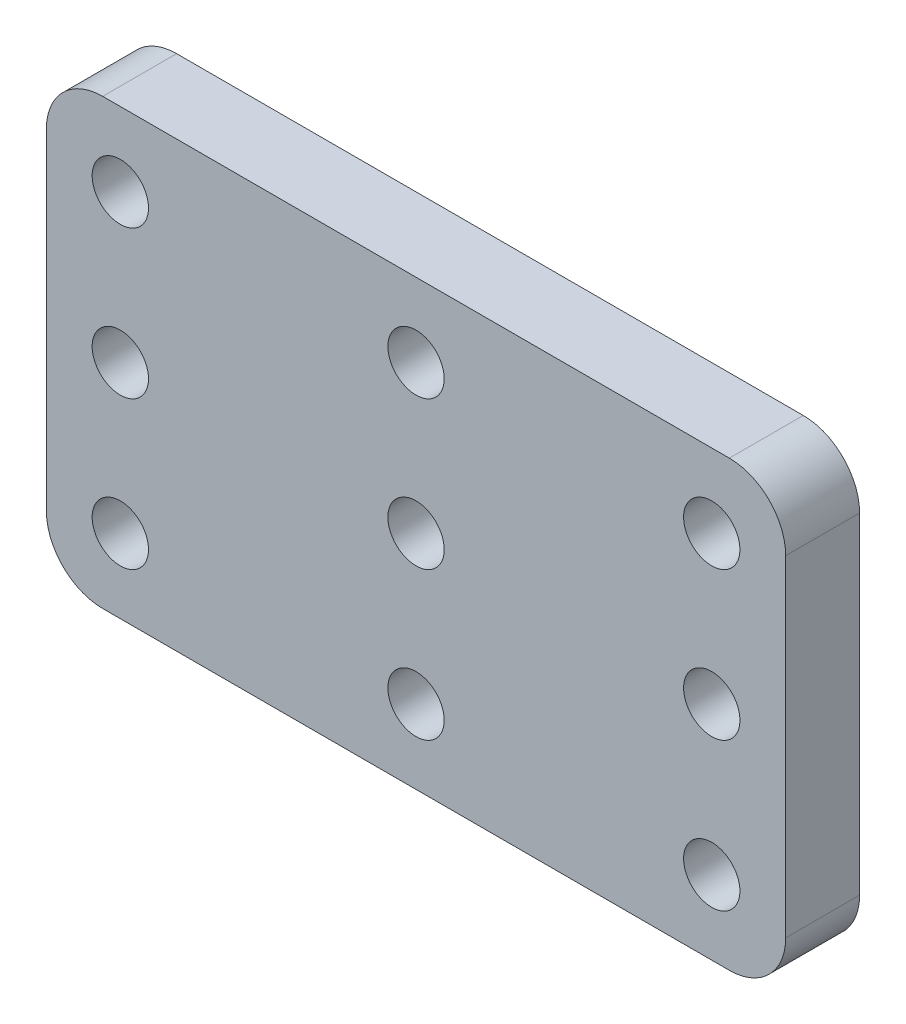
from build123d import *

# Parameters (mm, degrees)
SKETCH1_W                     = 49.9999
SKETCH1_H                     = 29.99994
BOSS_EXTRUDE1_DEPTH           = 4.99999
SKETCH2_R                     = 1.905
CUT_EXTRUDE1_DEPTH            = 4.99999
LPATTERN1_COUNT               = 2
LPATTERN1_PITCH               = 9.99998
LPATTERN1_COL_COUNT           = 2
LPATTERN1_COL_PITCH           = 9.99998
LPATTERN2_COUNT               = 2
LPATTERN2_PITCH               = 19.99996
LPATTERN2_COPY_1_SKETCH_R     = 1.905
LPATTERN2_COPY_1_DEPTH        = 4.99999
LPATTERN2_COPY_2_SKETCH_R     = 1.905
LPATTERN2_COPY_2_DEPTH        = 4.99999
LPATTERN2_COL_COUNT           = 2
LPATTERN2_COL_PITCH           = 19.99996
LPATTERN2_COL_COPY_1_SKETCH_R = 1.905
LPATTERN2_COL_COPY_1_DEPTH    = 4.99999
LPATTERN2_COL_COPY_2_SKETCH_R = 1.905
LPATTERN2_COL_COPY_2_DEPTH    = 4.99999
FILLET1_R                     = 3.81


with BuildPart() as part:
    # Sketch1 → Boss-Extrude1 (new body)
    with BuildSketch(Plane.XY):
        Rectangle(SKETCH1_W, SKETCH1_H)
    extrude(amount=BOSS_EXTRUDE1_DEPTH)

    # Sketch2 → Cut-Extrude1 (cut)
    with BuildSketch(Plane.XY.offset(4.99999)):
        Circle(SKETCH2_R)
    cut_extrude1 = extrude(amount=-CUT_EXTRUDE1_DEPTH, mode=Mode.SUBTRACT)

    # LPattern1: Cut-Extrude1 ×2
    with Locations(*[(0, i * LPATTERN1_PITCH, 0) for i in range(1, LPATTERN1_COUNT)]):
        add(cut_extrude1, mode=Mode.SUBTRACT)

    # LPattern1 col: Cut-Extrude1 ×2
    with Locations(*[(0, -i * LPATTERN1_COL_PITCH, 0) for i in range(1, LPATTERN1_COL_COUNT)]):
        add(cut_extrude1, mode=Mode.SUBTRACT)

    # LPattern2: Cut-Extrude1 ×2
    with Locations(*[(-i * LPATTERN2_PITCH, 0, 0) for i in range(1, LPATTERN2_COUNT)]):
        add(cut_extrude1, mode=Mode.SUBTRACT)

    # LPattern2 copy 1 sketch → LPattern2 copy 1 (cut)
    with BuildSketch(Plane(origin=(-19.99996, 9.99998, 4.99999), x_dir=(1, 0, 0), z_dir=(0, 0, 1))):
        Circle(LPATTERN2_COPY_1_SKETCH_R)
    extrude(amount=-LPATTERN2_COPY_1_DEPTH, mode=Mode.SUBTRACT)

    # LPattern2 copy 2 sketch → LPattern2 copy 2 (cut)
    with BuildSketch(Plane(origin=(-19.99996, -9.99998, 4.99999), x_dir=(1, 0, 0), z_dir=(0, 0, 1))):
        Circle(LPATTERN2_COPY_2_SKETCH_R)
    extrude(amount=-LPATTERN2_COPY_2_DEPTH, mode=Mode.SUBTRACT)

    # LPattern2 col: Cut-Extrude1 ×2
    with Locations(*[(i * LPATTERN2_COL_PITCH, 0, 0) for i in range(1, LPATTERN2_COL_COUNT)]):
        add(cut_extrude1, mode=Mode.SUBTRACT)

    # LPattern2 col copy 1 sketch → LPattern2 col copy 1 (cut)
    with BuildSketch(Plane(origin=(19.99996, 9.99998, 4.99999), x_dir=(1, 0, 0), z_dir=(0, 0, 1))):
        Circle(LPATTERN2_COL_COPY_1_SKETCH_R)
    extrude(amount=-LPATTERN2_COL_COPY_1_DEPTH, mode=Mode.SUBTRACT)

    # LPattern2 col copy 2 sketch → LPattern2 col copy 2 (cut)
    with BuildSketch(Plane(origin=(19.99996, -9.99998, 4.99999), x_dir=(1, 0, 0), z_dir=(0, 0, 1))):
        Circle(LPATTERN2_COL_COPY_2_SKETCH_R)
    extrude(amount=-LPATTERN2_COL_COPY_2_DEPTH, mode=Mode.SUBTRACT)

    # Fillet1
    fillet1_edges = [part.edges().sort_by_distance(p)[0] for p in [
        (24.99995, -14.99997, 2.499995),
        (-24.99995, -14.99997, 2.499995),
        (-24.99995, 14.99997, 2.499995),
        (24.99995, 14.99997, 2.499995),
    ]]
    fillet(fillet1_edges, radius=FILLET1_R)


solid = part.part
